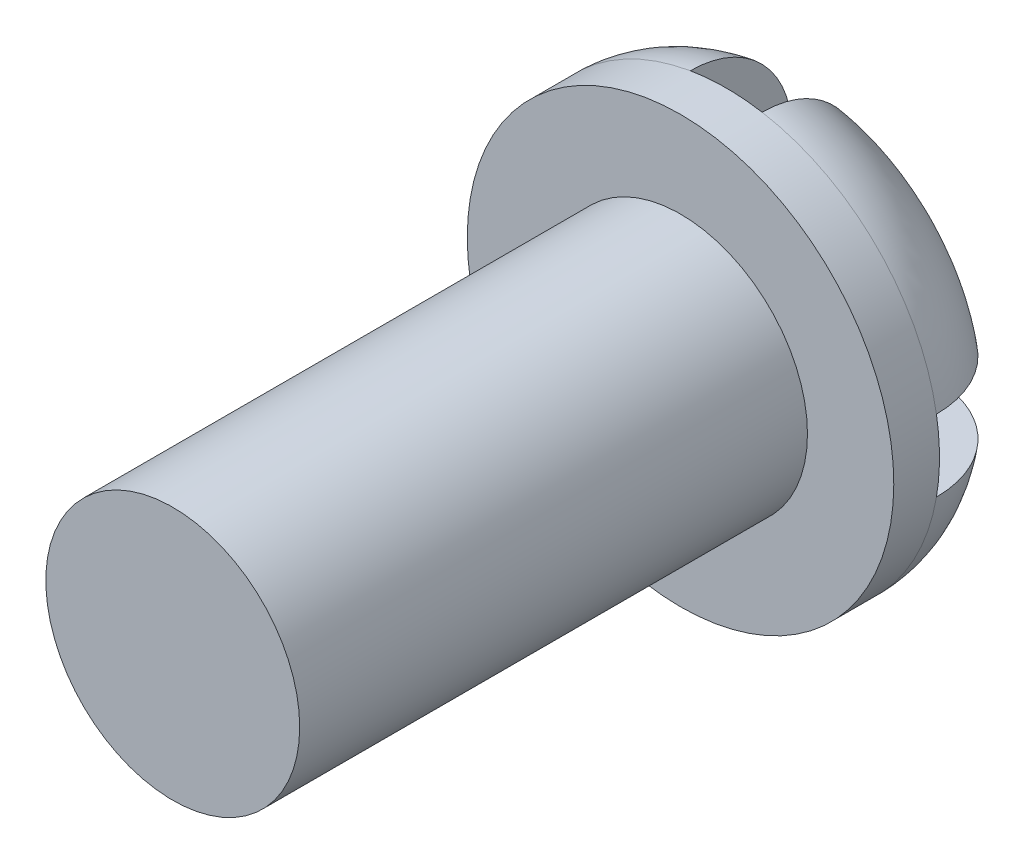
from build123d import *

# Parameters (mm, degrees)
SKETCH_1_R          = 2.5
EXTRUDE_1_DEPTH     = 10
SKETCH_2_R          = 4.2
EXTRUDE_2_DEPTH     = 2.9
FILLET_1_R          = 2
CUT_EXTRUDE_1_DEPTH = 2


with BuildPart() as part:
    # 草图1 → 凸台-拉伸1 (new body)
    with BuildSketch(Plane.XY):
        Circle(SKETCH_1_R)
    extrude(amount=EXTRUDE_1_DEPTH)

    # 草图2 → 凸台-拉伸2 (add)
    with BuildSketch(Plane(origin=(0, 0, 0), x_dir=(-1, 0, 0), z_dir=(0, 0, -1))):
        Circle(SKETCH_2_R)
    extrude(amount=EXTRUDE_2_DEPTH)

    # 圆角1
    fillet_1_edges = [part.edges().sort_by_distance(p)[0] for p in [
        (4.2, 0, -2.9),
    ]]
    fillet(fillet_1_edges, radius=FILLET_1_R)

    # 草图3 → 切除-拉伸1 (cut)
    with BuildSketch(Plane(origin=(0, 0, -2.9), x_dir=(-1, 0, 0), z_dir=(0, 0, -1))):
        Polygon((-0.707106781, 0.707106781), (-0.707106781, 6.006401657), (0.707106781, 6.006401657), (0.707106781, 0.707106781), (6.006401657, 0.707106781), (6.006401657, -0.707106781), (0.707106781, -0.707106781), (0.707106781, -6.006401657), (-0.707106781, -6.006401657), (-0.707106781, -0.707106781), (-6.006401657, -0.707106781), (-6.006401657, 0.707106781), align=None)
    extrude(amount=-CUT_EXTRUDE_1_DEPTH, mode=Mode.SUBTRACT)


solid = part.part
